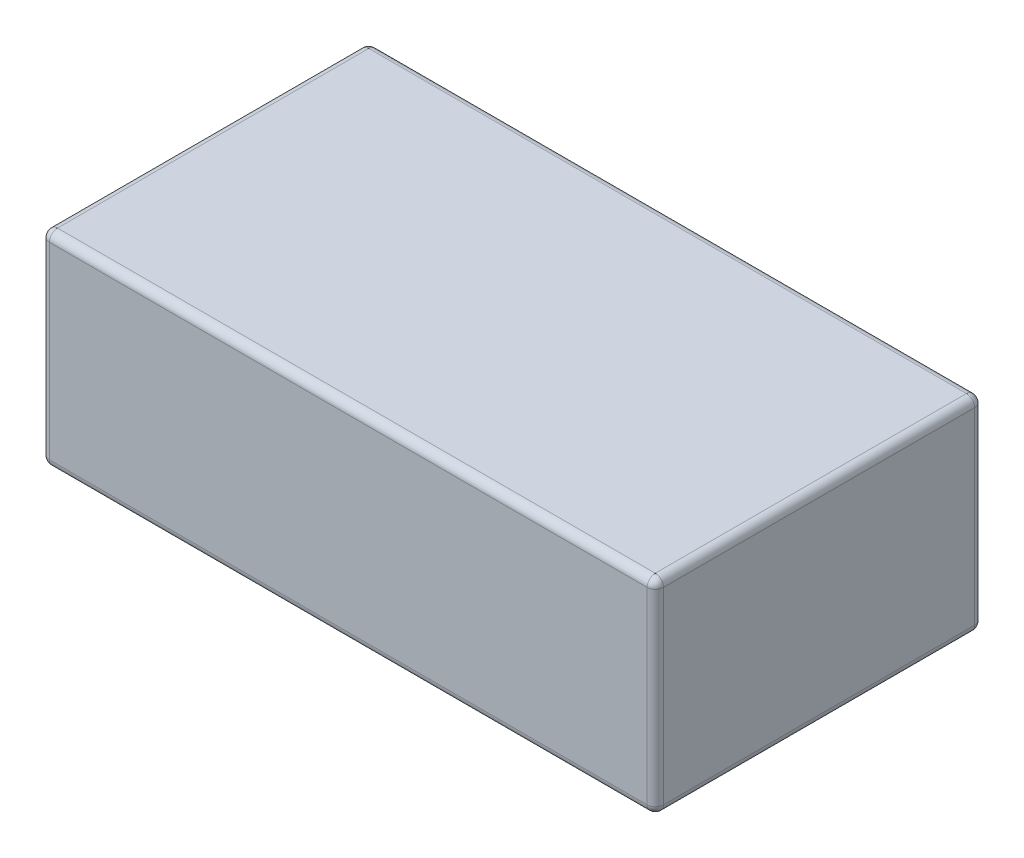
from build123d import *

# Parameters (mm, degrees)
BOSS_EXTRUDE1_DEPTH = 0.25
FILLET2_R           = 0.02


with BuildPart() as part:
    # Sketch1 → Boss-Extrude1 (new, symmetric)
    with BuildSketch(Plane(origin=(0, 0, 0), x_dir=(1, 0, 0), z_dir=(0, 1, 0))):
        with BuildLine():
            Line((-0.73, -0.4), (0.73, -0.4))
            ThreePointArc((0.73, -0.4), (0.744142136, -0.394142136), (0.75, -0.38))
            Line((0.75, -0.38), (0.75, 0.38))
            ThreePointArc((0.75, 0.38), (0.744142136, 0.394142136), (0.73, 0.4))
            Line((0.73, 0.4), (-0.73, 0.4))
            ThreePointArc((-0.73, 0.4), (-0.744142136, 0.394142136), (-0.75, 0.38))
            Line((-0.75, 0.38), (-0.75, -0.38))
            ThreePointArc((-0.75, -0.38), (-0.744142136, -0.394142136), (-0.73, -0.4))
        make_face()
    extrude(amount=BOSS_EXTRUDE1_DEPTH, both=True)

    # Fillet2
    fillet2_edges = [part.edges().sort_by_distance(p)[0] for p in [
        (0.744142136, 0.25, 0.394142136),
        (0, -0.25, 0.4),
        (-0.744142136, -0.25, 0.394142136),
        (0.75, 0.25, 0),
        (0.744142136, 0.25, -0.394142136),
        (0, 0.25, -0.4),
        (-0.744142136, 0.25, -0.394142136),
        (-0.75, 0.25, 0),
        (-0.744142136, 0.25, 0.394142136),
        (0, 0.25, 0.4),
        (-0.75, -0.25, 0),
        (-0.744142136, -0.25, -0.394142136),
        (0, -0.25, -0.4),
        (0.744142136, -0.25, -0.394142136),
        (0.75, -0.25, 0),
        (0.744142136, -0.25, 0.394142136),
    ]]
    fillet(fillet2_edges, radius=FILLET2_R)


solid = part.part
